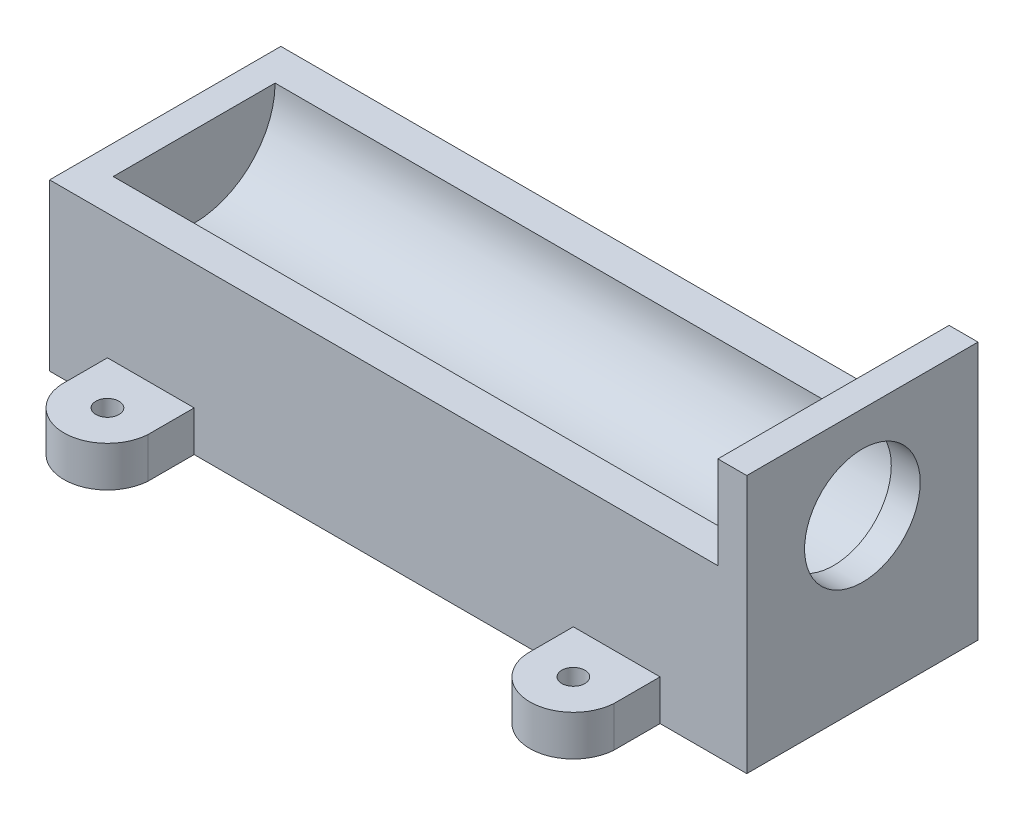
from build123d import *

# Parameters (mm, degrees)
BOSS_EXTRUDE1_DEPTH     = 55.3
SKETCH3_W               = 40
SKETCH3_H               = 19
BOSS_EXTRUDE2_DEPTH     = 5
SKETCH5_R               = 10
CUT_EXTRUDE1_DEPTH      = 10
SKETCH6_W               = 15
SKETCH6_H               = 15
SKETCH6_R               = 2
BOSS_EXTRUDE3_DEPTH     = 5
BOSS_EXTRUDE3_2_DEPTH   = 5
BOSS_EXTRUDE3_3_DEPTH   = 5
BOSS_EXTRUDE3_4_DEPTH   = 5
FILLET5_R               = 7
FILLET2_R               = 7
FILLET3_R               = 7
FILLET4_R               = 7
BOSS_EXTRU_1_START      = 110.6
BOSS_EXTRU_1_DEPTH      = 110.6
ESQUISSE11_W            = 40
ESQUISSE11_H            = 9.66
BOSS_EXTRU_5_DEPTH      = 120.6
ESQUISSE12_R            = 2.003722313
ESQUISSE12_R_2          = 2
BOSS_EXTRU_6_DEPTH      = 7
ESQUISSE13_W            = 97.971196864
ESQUISSE13_H            = 26.942074747
ENL_V_MAT_EXTRU_2_DEPTH = 20
ESQUISSE16_R            = 2
ENL_V_MAT_EXTRU_3_DEPTH = 20
BOSS_EXTRU_7_DEPTH      = 5


with BuildPart() as part:
    # Sketch1 → Boss-Extrude1 (new, symmetric)
    with BuildSketch(Plane(origin=(0, 0, 0), x_dir=(0, 0, -1), z_dir=(1, 0, 0))):
        with BuildLine():
            ThreePointArc((-15, 0), (0, -15), (15, 0))
            Line((15, 0), (20, 0))
            Line((20, 0), (20, -19))
            Line((20, -19), (-20, -19))
            Line((-20, -19), (-20, 0))
            Line((-20, 0), (-15, 0))
        make_face()
    extrude(amount=BOSS_EXTRUDE1_DEPTH, both=True)

    # Sketch3 → Boss-Extrude2 (add)
    with BuildSketch(Plane(origin=(55.3, 0, 0), x_dir=(0, 0, -1), z_dir=(1, 0, 0))):
        with Locations((0, -9.5)):
            Rectangle(SKETCH3_W, SKETCH3_H)
    boss_extrude2 = extrude(amount=BOSS_EXTRUDE2_DEPTH)

    # Mirror1: Boss-Extrude2 across plane
    add(boss_extrude2.mirror(Plane(origin=(0, 0, 0), x_dir=(0, 0, 1), z_dir=(1, 0, 0))))

    # Sketch5 → Cut-Extrude1 (cut)
    with BuildSketch(Plane(origin=(60.3, 0, 0), x_dir=(0, 0, -1), z_dir=(1, 0, 0))):
        Circle(SKETCH5_R)
    extrude(amount=-CUT_EXTRUDE1_DEPTH, mode=Mode.SUBTRACT)

    # Esquisse3 → Boss.-Extru.1 (add)
    with BuildSketch(Plane(origin=(-55.3, 0, 0), x_dir=(0, 0, -1), z_dir=(1, 0, 0)).offset(BOSS_EXTRU_1_START)):
        with BuildLine():
            Line((-15, 0), (-14, 0))
            ThreePointArc((-14, 0), (0, -14), (14, 0))
            Line((14, 0), (15, 0))
            ThreePointArc((15, 0), (0, -15), (-15, 0))
        make_face()
    extrude(amount=-BOSS_EXTRU_1_DEPTH)



with BuildPart() as body_2:
    # Sketch6 → Boss-Extrude3 (new body)
    with BuildSketch(Plane.XZ.offset(19)):
        with Locations((37.8, 27.5)):
            Rectangle(SKETCH6_W, SKETCH6_H)
        with Locations(Location((37.8, 27.5, 0), (0, 0, 270))):
            Circle(SKETCH6_R, mode=Mode.SUBTRACT)
    extrude(amount=-BOSS_EXTRUDE3_DEPTH)

    # Fillet5
    fillet5_edges = [body_2.edges().sort_by_distance(p)[0] for p in [
        (30.3, -16.5, 35),
        (45.3, -16.5, 35),
    ]]
    fillet(fillet5_edges, radius=FILLET5_R)


with BuildPart() as body_3:
    # Sketch6 → Boss-Extrude3 2 (new body)
    with BuildSketch(Plane.XZ.offset(19)):
        with Locations((-42.8, 27.5)):
            Rectangle(SKETCH6_W, SKETCH6_H)
        with Locations(Location((-42.8, 27.5, 0), (0, 0, 270))):
            Circle(SKETCH6_R, mode=Mode.SUBTRACT)
    extrude(amount=-BOSS_EXTRUDE3_2_DEPTH)

    # Fillet2
    fillet2_edges = [body_3.edges().sort_by_distance(p)[0] for p in [
        (-35.3, -16.5, 35),
        (-50.3, -16.5, 35),
    ]]
    fillet(fillet2_edges, radius=FILLET2_R)


with BuildPart() as body_4:
    # Sketch6 → Boss-Extrude3 3 (new body)
    with BuildSketch(Plane.XZ.offset(19)):
        with Locations((37.8, -27.5)):
            Rectangle(SKETCH6_W, SKETCH6_H)
        with Locations(Location((37.8, -27.5, 0), (0, 0, 90))):
            Circle(SKETCH6_R, mode=Mode.SUBTRACT)
    extrude(amount=-BOSS_EXTRUDE3_3_DEPTH)

    # Fillet4
    fillet4_edges = [body_4.edges().sort_by_distance(p)[0] for p in [
        (30.3, -16.5, -35),
        (45.3, -16.5, -35),
    ]]
    fillet(fillet4_edges, radius=FILLET4_R)


with BuildPart() as body_5:
    # Sketch6 → Boss-Extrude3 4 (new body)
    with BuildSketch(Plane.XZ.offset(19)):
        with Locations((-42.8, -27.5)):
            Rectangle(SKETCH6_W, SKETCH6_H)
        with Locations(Location((-42.8, -27.5, 0), (0, 0, 90))):
            Circle(SKETCH6_R, mode=Mode.SUBTRACT)
    extrude(amount=-BOSS_EXTRUDE3_4_DEPTH)

    # Fillet3
    fillet3_edges = [body_5.edges().sort_by_distance(p)[0] for p in [
        (-50.3, -16.5, -35),
        (-35.3, -16.5, -35),
    ]]
    fillet(fillet3_edges, radius=FILLET3_R)


with BuildPart() as part_1:
    add(part.part)

    add(body_2.part)  # Boss.-Extru.5 merges body 2

    add(body_3.part)  # Boss.-Extru.5 merges body 3

    add(body_4.part)  # Boss.-Extru.5 merges body 4

    add(body_5.part)  # Boss.-Extru.5 merges body 5
    # Esquisse11 → Boss.-Extru.5 (add)
    with BuildSketch(Plane.ZY.offset(60.3)):
        with Locations((0, -23.83)):
            Rectangle(ESQUISSE11_W, ESQUISSE11_H)
    extrude(amount=-BOSS_EXTRU_5_DEPTH)

    # Esquisse12 → Boss.-Extru.6 (add)
    # profile 1 of 4: a face of its own
    with BuildSketch(Plane.XZ.offset(28.66)):
        with BuildLine():
            Line((-50.3, 28), (-50.3, 20))
            Line((-50.3, 20), (-35.3, 20))
            Line((-35.3, 20), (-35.3, 28))
            ThreePointArc((-35.3, 28), (-42.8, 35.016648189), (-50.3, 28))
        make_face()
        with Locations(Location((-42.8, 27.5, 0), (0, 0, 270))):
            Circle(ESQUISSE12_R, mode=Mode.SUBTRACT)
    # profile 2 of 4: a face of its own
    with BuildSketch(Plane.XZ.offset(28.66)):
        with BuildLine():
            Line((-35.3, -20), (-50.3, -20))
            Line((-50.3, -20), (-50.3, -28))
            ThreePointArc((-50.3, -28), (-42.8, -35.016648189), (-35.3, -28))
            Line((-35.3, -28), (-35.3, -20))
        make_face()
    # profile 3 of 4: a face of its own
    with BuildSketch(Plane.XZ.offset(28.66)):
        with BuildLine():
            Line((45.3, -20), (30.3, -20))
            Line((30.3, -20), (30.3, -28))
            ThreePointArc((30.3, -28), (37.8, -35.016648189), (45.3, -28))
            Line((45.3, -28), (45.3, -20))
        make_face()
        with Locations(Location((37.8, -27.5, 0), (0, 0, 90))):
            Circle(ESQUISSE12_R_2, mode=Mode.SUBTRACT)
    # profile 4 of 4: a face of its own
    with BuildSketch(Plane.XZ.offset(28.66)):
        with BuildLine():
            Line((30.3, 28), (30.3, 20))
            Line((30.3, 20), (45.3, 20))
            Line((45.3, 20), (45.3, 28))
            ThreePointArc((45.3, 28), (37.8, 35.016648189), (30.3, 28))
        make_face()
        with Locations(Location((37.8, 27.5, 0), (0, 0, 270))):
            Circle(ESQUISSE12_R_2, mode=Mode.SUBTRACT)
    extrude(amount=-BOSS_EXTRU_6_DEPTH)

    # Esquisse13 → Enlèv. mat.-Extru.2 (cut)
    with BuildSketch(Plane(origin=(0, 0, 0), x_dir=(1, 0, 0), z_dir=(0, 1, 0))):
        Polygon((-50.3, -20), (-50.3, -48.328087832), (45.678803054, -48.328087832), (45.3, -20), align=None)
        with Locations((-1.314401568, 33.471037373)):
            Rectangle(ESQUISSE13_W, ESQUISSE13_H)
    extrude(amount=-ENL_V_MAT_EXTRU_2_DEPTH, mode=Mode.SUBTRACT)

    # Esquisse16 → Enlèv. mat.-Extru.3 (cut)
    with BuildSketch(Plane.XZ.offset(28.66)):
        with Locations(Location((-42.8, -27.5, 0), (0, 0, 270))):
            Circle(ESQUISSE16_R)
    extrude(amount=-ENL_V_MAT_EXTRU_3_DEPTH, mode=Mode.SUBTRACT)

    # Esquisse18 → Boss.-Extru.7 (add)
    with BuildSketch(Plane(origin=(60.3, 0, 0), x_dir=(0, 0, -1), z_dir=(1, 0, 0))):
        with BuildLine():
            Line((-20, 0), (-20, 16))
            Line((-20, 16), (20, 16))
            Line((20, 16), (20, 0))
            Line((20, 0), (10, 0))
            ThreePointArc((10, 0), (0, 10), (-10, 0))
            Line((-10, 0), (-20, 0))
        make_face()
    extrude(amount=-BOSS_EXTRU_7_DEPTH)


solid = part_1.part
